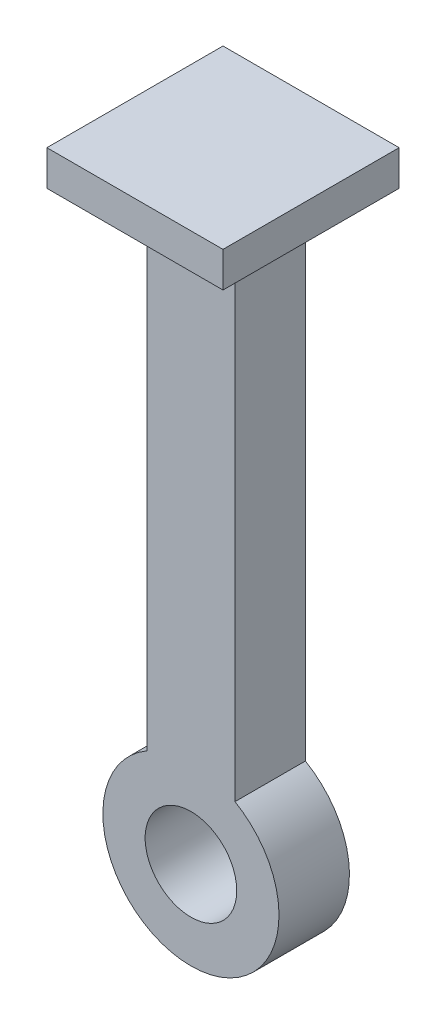
from build123d import *

# Parameters (mm, degrees)
SKETCH1_R           = 6.35
SKETCH1_R_2         = 3.302
BOSS_EXTRUDE1_DEPTH = 5.08
SKETCH2_W           = 12.7
SKETCH2_H           = 12.7
BOSS_EXTRUDE2_DEPTH = 2.54


with BuildPart() as part:
    # Sketch1 → Boss-Extrude1 (new body)
    # profile 1 of 2: a face of its own
    with BuildSketch(Plane.XY):
        Circle(SKETCH1_R)
        Circle(SKETCH1_R_2, mode=Mode.SUBTRACT)
    # profile 2 of 2: a face of its own
    with BuildSketch(Plane.XY):
        with BuildLine():
            ThreePointArc((-3.175, 5.499261314), (0, 6.35), (3.175, 5.499261314))
            Line((3.175, 5.499261314), (3.175, 41.059261314))
            Line((3.175, 41.059261314), (-3.175, 41.059261314))
            Line((-3.175, 41.059261314), (-3.175, 5.499261314))
        make_face()
    extrude(amount=BOSS_EXTRUDE1_DEPTH)

    # Sketch2 → Boss-Extrude2 (add)
    with BuildSketch(Plane(origin=(0, 41.059261314, 0), x_dir=(1, 0, 0), z_dir=(0, 1, 0))):
        with Locations((0, -2.767803864)):
            Rectangle(SKETCH2_W, SKETCH2_H)
    extrude(amount=BOSS_EXTRUDE2_DEPTH)


solid = part.part
